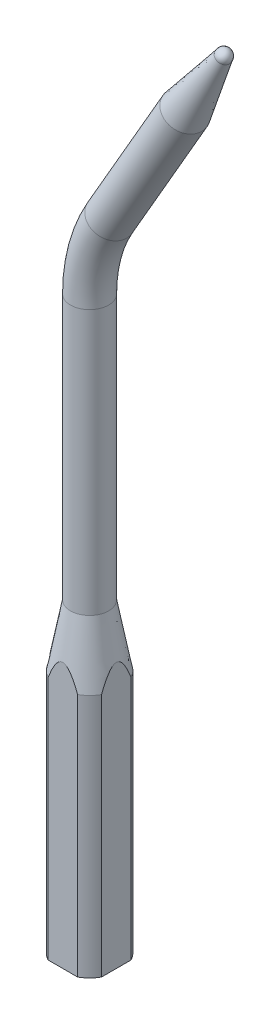
from build123d import *

# Parameters (mm, degrees)
SKETCH_2_R          = 2.5
CHAMFER_1_SIZE      = 10
CHAMFER_1_SIZE2     = 1.583844403
SKETCH_4_W          = 3.296860699
SKETCH_4_H          = 5.658889041
SKETCH_4_W_2        = 5.658889041
SKETCH_4_H_2        = 3.296860699
CUT_EXTRUDE_1_DEPTH = 40
DOME_1_FACE_RADIUS  = 0.916155597
DOME_1_HEIGHT       = 1


with BuildPart() as part:
    # 扫描1: sweep along a path in 草图1
    with BuildLine(Plane.XY) as sweep_1_path:
        Line((0, 0), (0, 34.641016151))
        ThreePointArc((0, 34.641016151), (0.681483474, 39.817397053), (2.679491924, 44.641016151))
        Line((2.679491924, 44.641016151), (17.5, 70.310889132))
    # 草图2 → 扫描1 (sweep)
    with BuildSketch(Plane(origin=(0, 0, 0), x_dir=(1, 0, 0), z_dir=(0, 1, 0))):
        Circle(SKETCH_2_R)
    sweep(path=sweep_1_path.line)

    # 草图3 → 旋转1 (revolve)
    with BuildSketch(Plane.XY, mode=Mode.PRIVATE) as revolve_1_sk:
        Polygon((0, 0), (2.5, 0), (4, -8), (4, -40), (0, -40), align=None)
    revolve(revolve_1_sk.sketch.rotate(Axis((0, 0, 0), (0, -1, 0)), 90), axis=Axis((0, 0, 0), (0, -1, 0)))

    # 倒角1
    chamfer_1_edges = [part.edges().sort_by_distance(p)[0] for p in [
        (15.334936491, 71.560889132, 0),
    ]]
    chamfer_1_side = [part.faces().sort_by_distance(p)[0] for p in [
        (7.924682453, 58.725952642, 0),
    ]]
    chamfer(chamfer_1_edges, length=CHAMFER_1_SIZE, length2=CHAMFER_1_SIZE2, reference=chamfer_1_side[0])

    # 草图4 → 切除-拉伸1 (cut)
    with BuildSketch(Plane.XZ.offset(40)):
        with Locations((5.148430349, -0.020531218)):
            Rectangle(SKETCH_4_W, SKETCH_4_H)
        with Locations((0.020531218, 5.148430349)):
            Rectangle(SKETCH_4_W_2, SKETCH_4_H_2)
        with Locations((-0.020531218, -5.148430349)):
            Rectangle(SKETCH_4_W_2, SKETCH_4_H_2)
        with Locations((-5.148430349, 0.020531218)):
            Rectangle(SKETCH_4_W, SKETCH_4_H)
    extrude(amount=-CUT_EXTRUDE_1_DEPTH, mode=Mode.SUBTRACT)

    # 圆顶1: a dome of height H over a round flat face of radius A is a cap of a sphere of radius (A * A + H * H) / (2 * H)
    dome_1_r = (DOME_1_FACE_RADIUS * DOME_1_FACE_RADIUS + DOME_1_HEIGHT * DOME_1_HEIGHT) / (2 * DOME_1_HEIGHT)
    dome_1_base = Plane((17.5, 70.310889132, 0), z_dir=(0.5, 0.866025403784, 0))
    with Locations(dome_1_base.offset(DOME_1_HEIGHT - dome_1_r)):
        dome_1_ball = Sphere(dome_1_r, mode=Mode.PRIVATE)
    add(split(dome_1_ball, bisect_by=dome_1_base, keep=Keep.TOP, mode=Mode.PRIVATE))


solid = part.part
